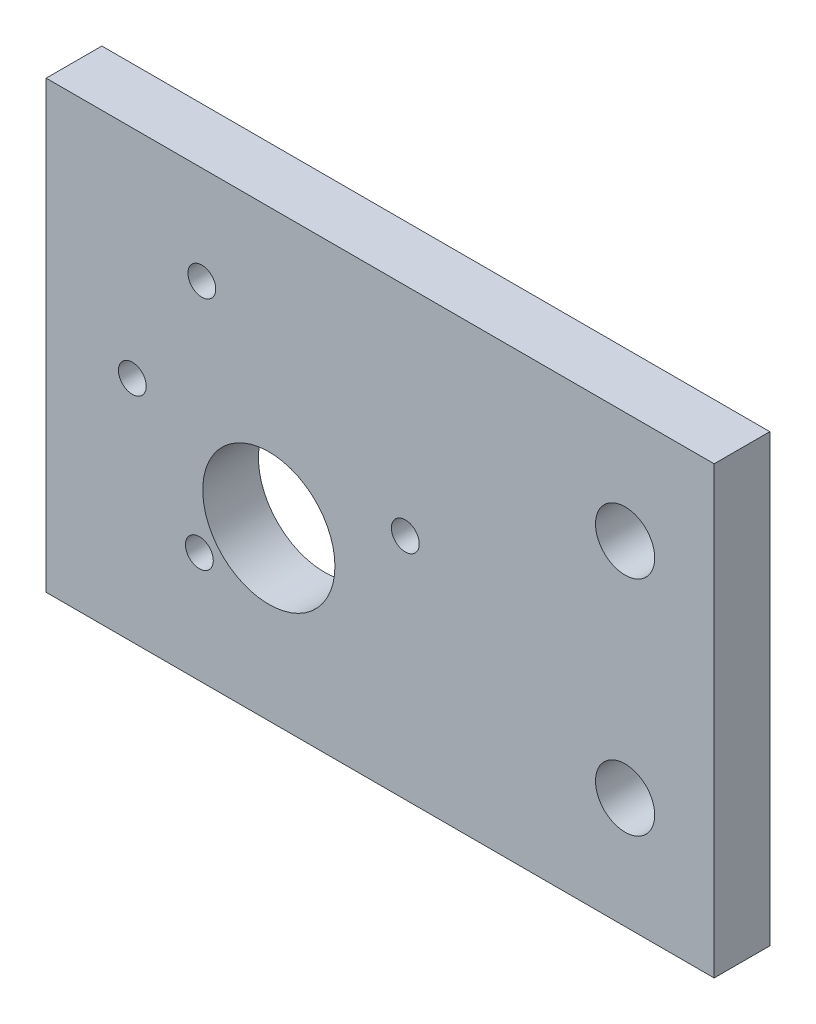
from build123d import *

# Parameters (mm, degrees)
SKETCH1_W                        = 76.2
SKETCH1_H                        = 50.8
BOSS_EXTRUDE1_DEPTH              = 6.35
F_19_32_0_59375_DIAMETER_HOLE1_D = 15.08125
F_1_8_0_125_DIAMETER_HOLE1_D     = 3.175
H_0_266_DIAMETER_HOLE1_D         = 6.7564


with BuildPart() as part:
    # Sketch1 → Boss-Extrude1 (new body)
    with BuildSketch(Plane.XY):
        Rectangle(SKETCH1_W, SKETCH1_H)
    extrude(amount=BOSS_EXTRUDE1_DEPTH)

    # 19/32 (0.59375) Diameter Hole1 (through all)
    with Locations(Plane.XY.offset(6.35)):
        with Locations((-12.7, -6.35)):
            Hole(F_19_32_0_59375_DIAMETER_HOLE1_D / 2)

    # 1/8 (0.125) Diameter Hole1 (through all)
    with Locations(Plane.XY.offset(6.35)):
        with Locations((-20.3454, 14.22428539), (-28.2702, 0.6604), (-20.6248, -12.74216218), (2.8702, 0.6604)):
            Hole(F_1_8_0_125_DIAMETER_HOLE1_D / 2)

    # H (0.266) Diameter Hole1 (through all)
    with Locations(Plane.XY.offset(6.35)):
        with Locations((27.94, 12.7), (27.94, -12.7)):
            Hole(H_0_266_DIAMETER_HOLE1_D / 2)


solid = part.part
